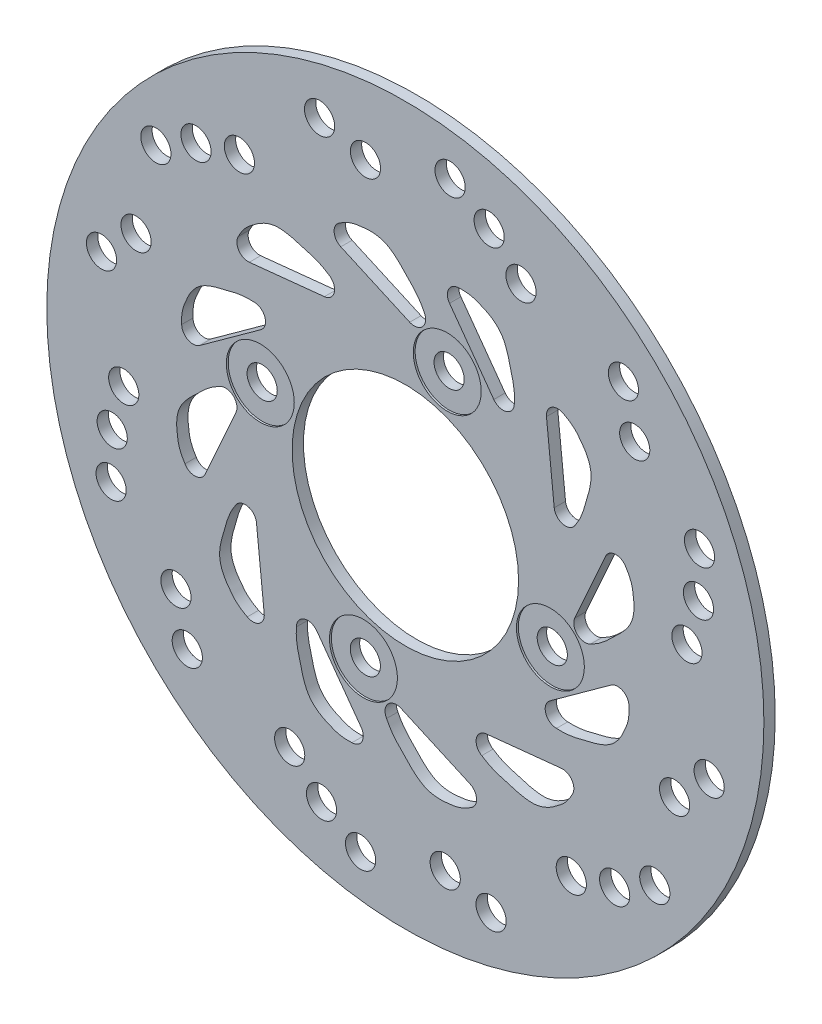
from build123d import *

# Parameters (mm, degrees)
SKETCH1_R           = 95
SKETCH1_R_2         = 30
BOSS_EXTRUDE1_DEPTH = 3
CUT_EXTRUDE1_REACH  = 136.384
SKETCH2_R           = 4
CIRPATTERN1_COUNT   = 6
SKETCH3_R           = 4
SKETCH3_R_2         = 9
CUT_EXTRUDE3_DEPTH  = 0.5
SKETCH4_R           = 4
CUT_EXTRUDE4_DEPTH  = 135.373546504
SKETCH6_R           = 4
CUT_EXTRUDE6_DEPTH  = 135.383778783


with BuildPart() as part:
    # Sketch1 → Boss-Extrude1 (new body)
    with BuildSketch(Plane.XY):
        Circle(SKETCH1_R)
        Circle(SKETCH1_R_2, mode=Mode.SUBTRACT)
    extrude(amount=BOSS_EXTRUDE1_DEPTH)

    # Sketch2 → Cut-Extrude1 (cut, up to next)
    with BuildSketch(Plane.XY.offset(3), mode=Mode.PRIVATE) as cut_extrude1_sk1:
        with Locations((-22.718806274, 79.830168743)):
            Circle(SKETCH2_R)
    cut_extrude1_tool1 = extrude(cut_extrude1_sk1.sketch, amount=-CUT_EXTRUDE1_REACH, mode=Mode.PRIVATE) & part.part
    # Sketch2 → Cut-Extrude1 (cut, up to next)
    with BuildSketch(Plane.XY.offset(3), mode=Mode.PRIVATE) as cut_extrude1_sk2:
        with Locations((-10.564303777, 76.271852513)):
            Circle(SKETCH2_R)
    cut_extrude1_tool2 = extrude(cut_extrude1_sk2.sketch, amount=-CUT_EXTRUDE1_REACH, mode=Mode.PRIVATE) & part.part
    # Sketch2 → Cut-Extrude1 (cut, up to next)
    with BuildSketch(Plane.XY.offset(3), mode=Mode.PRIVATE) as cut_extrude1_sk3:
        with Locations((11.856339474, 83.159047699)):
            Circle(SKETCH2_R)
    cut_extrude1_tool3 = extrude(cut_extrude1_sk3.sketch, amount=-CUT_EXTRUDE1_REACH, mode=Mode.PRIVATE) & part.part
    # Sketch2 → Cut-Extrude1 (cut, up to next)
    with BuildSketch(Plane.XY.offset(3), mode=Mode.PRIVATE) as cut_extrude1_sk4:
        with Locations((22.204244699, 76.856824793)):
            Circle(SKETCH2_R)
    cut_extrude1_tool4 = extrude(cut_extrude1_sk4.sketch, amount=-CUT_EXTRUDE1_REACH, mode=Mode.PRIVATE) & part.part
    # Sketch2 → Cut-Extrude1 (cut, up to next)
    with BuildSketch(Plane.XY.offset(3), mode=Mode.PRIVATE) as cut_extrude1_sk5:
        with Locations((30.641772331, 68.454961752)):
            Circle(SKETCH2_R)
    cut_extrude1_tool5 = extrude(cut_extrude1_sk5.sketch, amount=-CUT_EXTRUDE1_REACH, mode=Mode.PRIVATE) & part.part
    cut_extrude1_1 = cut_extrude1_tool1.solids().sort_by_distance((-22.718806, 79.830169, 3))[0]
    add(cut_extrude1_1, mode=Mode.SUBTRACT)
    cut_extrude1_2 = cut_extrude1_tool2.solids().sort_by_distance((-10.564304, 76.271853, 3))[0]
    add(cut_extrude1_2, mode=Mode.SUBTRACT)
    cut_extrude1_3 = cut_extrude1_tool3.solids().sort_by_distance((11.856339, 83.159048, 3))[0]
    add(cut_extrude1_3, mode=Mode.SUBTRACT)
    cut_extrude1_4 = cut_extrude1_tool4.solids().sort_by_distance((22.204245, 76.856825, 3))[0]
    add(cut_extrude1_4, mode=Mode.SUBTRACT)
    cut_extrude1_5 = cut_extrude1_tool5.solids().sort_by_distance((30.641772, 68.454962, 3))[0]
    add(cut_extrude1_5, mode=Mode.SUBTRACT)
    cut_extrude1 = cut_extrude1_1 + cut_extrude1_2 + cut_extrude1_3 + cut_extrude1_4 + cut_extrude1_5  # Cut-Extrude1 as one shape, for the pattern or mirror that repeats it

    # CirPattern1: Cut-Extrude1 ×6 about axis
    cirpattern1_axis = Axis((0, 0, 0), (0, 0, 1))
    for i in range(1, CIRPATTERN1_COUNT):
        add(cut_extrude1.rotate(cirpattern1_axis, i * 360 / CIRPATTERN1_COUNT), mode=Mode.SUBTRACT)

    # Sketch3 → Cut-Extrude3 (cut)
    with BuildSketch(Plane.XY.offset(3)):
        with Locations((22.204244699, 76.856824793)):
            Circle(SKETCH3_R)
        with Locations((11.10212235, 38.428412397)):
            Circle(SKETCH3_R_2)
        with Locations((38.428412397, -11.10212235)):
            Circle(SKETCH3_R_2)
        with Locations((-11.10212235, -38.428412397)):
            Circle(SKETCH3_R_2)
        with Locations((-38.428412397, 11.10212235)):
            Circle(SKETCH3_R_2)
    extrude(amount=-CUT_EXTRUDE3_DEPTH, mode=Mode.SUBTRACT)

    # Sketch4 → Cut-Extrude4 (cut, through all)
    with BuildSketch(Plane.XY.offset(2.5)):
        with Locations((11.10212235, 38.428412397)):
            Circle(SKETCH4_R)
        with Locations((38.428412397, -11.10212235)):
            Circle(SKETCH4_R)
        with Locations((-11.10212235, -38.428412397)):
            Circle(SKETCH4_R)
        with Locations((-38.428412397, 11.10212235)):
            Circle(SKETCH4_R)
    extrude(amount=-CUT_EXTRUDE4_DEPTH, mode=Mode.SUBTRACT)

    # Sketch6 → Cut-Extrude6 (cut, through all)
    with BuildSketch(Plane.XY.offset(3)):
        with Locations((22.204244699, 76.856824793)):
            Circle(SKETCH6_R)
        with BuildLine():
            Line((11.713067763, 54.490554937), (23.436494357, 38.286812502))
            ThreePointArc((23.436494357, 38.286812502), (26.791262383, 37.191234333), (28.867055722, 40.045326491))
            add(Edge.make_bspline(
                [(14.143629128, 59.249068926), (17.597044301, 59.429990737), (19.224423112, 58.427017972), (21.525123791, 57.578586895), (26.020798822, 55.13924055), (27.454832313, 49.544497782), (29.115166994, 42.508006827), (28.861136389, 40.957282294), (28.867055722, 40.045326491)],
                knots=[0, 0, 0, 0, 0.283284899, 0.338844181, 0.555592824, 0.777992957, 0.822433675, 1, 1, 1, 1], degree=3))
            ThreePointArc((14.143629128, 59.249068926), (11.471968412, 57.613704048), (11.713067763, 54.490554937))
        make_face()
        with BuildLine():
            Line((37.389091708, 41.33367096), (39.44000574, 21.439105078))
            ThreePointArc((39.44000574, 21.439105078), (41.79753099, 18.812922539), (45.022266833, 20.246742183))
            add(Edge.make_bspline(
                [(41.87327659, 44.239384277), (44.954482765, 42.669359575), (45.862347774, 40.987070275), (47.43059747, 39.101957069), (50.104293082, 34.741583651), (48.54883113, 29.179377541), (46.468477666, 22.255430279), (45.473118442, 21.039478742), (45.022266833, 20.246742183)],
                knots=[0, 0, 0, 0, 0.283284899, 0.338844181, 0.555592824, 0.777992957, 0.822433675, 1, 1, 1, 1], degree=3))
            ThreePointArc((41.87327659, 44.239384277), (38.7418681, 44.158947106), (37.389091708, 41.33367096))
        make_face()
        with BuildLine():
            Line((53.046738724, 17.10146323), (44.875599435, -1.153193238))
            ThreePointArc((44.875599435, -1.153193238), (45.604184922, -4.606296657), (49.113797905, -4.976940342))
            add(Edge.make_bspline(
                [(58.383013405, 17.375792336), (60.266403875, 14.475507973), (60.211493387, 12.564670198), (60.627080861, 10.147989425), (60.762382473, 5.034947468), (56.634209853, 0.995666652), (51.370597273, -3.960470839), (49.900615131, -4.515836148), (49.113797905, -4.976940342)],
                knots=[0, 0, 0, 0, 0.283284899, 0.338844181, 0.555592824, 0.777992957, 0.822433675, 1, 1, 1, 1], degree=3))
            ThreePointArc((58.383013405, 17.375792336), (55.630915518, 18.871835948), (53.046738724, 17.10146323))
        make_face()
        with BuildLine():
            Line((54.490554937, -11.713067763), (38.286812502, -23.436494357))
            ThreePointArc((38.286812502, -23.436494357), (37.191234333, -26.791262383), (40.045326491, -28.867055722))
            add(Edge.make_bspline(
                [(59.249068926, -14.143629128), (59.429990737, -17.597044301), (58.427017972, -19.224423112), (57.578586895, -21.525123791), (55.13924055, -26.020798822), (49.544497782, -27.454832313), (42.508006827, -29.115166994), (40.957282294, -28.861136389), (40.045326491, -28.867055722)],
                knots=[0, 0, 0, 0, 0.283284899, 0.338844181, 0.555592824, 0.777992957, 0.822433675, 1, 1, 1, 1], degree=3))
            ThreePointArc((59.249068926, -14.143629128), (57.613704048, -11.471968412), (54.490554937, -11.713067763))
        make_face()
        with BuildLine():
            Line((41.33367096, -37.389091708), (21.439105078, -39.44000574))
            ThreePointArc((21.439105078, -39.44000574), (18.812922539, -41.79753099), (20.246742183, -45.022266833))
            add(Edge.make_bspline(
                [(44.239384277, -41.87327659), (42.669359575, -44.954482765), (40.987070275, -45.862347774), (39.101957069, -47.43059747), (34.741583651, -50.104293082), (29.179377541, -48.54883113), (22.255430279, -46.468477666), (21.039478742, -45.473118442), (20.246742183, -45.022266833)],
                knots=[0, 0, 0, 0, 0.283284899, 0.338844181, 0.555592824, 0.777992957, 0.822433675, 1, 1, 1, 1], degree=3))
            ThreePointArc((44.239384277, -41.87327659), (44.158947106, -38.7418681), (41.33367096, -37.389091708))
        make_face()
        with BuildLine():
            Line((17.10146323, -53.046738724), (-1.153193238, -44.875599435))
            ThreePointArc((-1.153193238, -44.875599435), (-4.606296657, -45.604184922), (-4.976940342, -49.113797905))
            add(Edge.make_bspline(
                [(17.375792336, -58.383013405), (14.475507973, -60.266403875), (12.564670198, -60.211493387), (10.147989425, -60.627080861), (5.034947468, -60.762382473), (0.995666652, -56.634209853), (-3.960470839, -51.370597273), (-4.515836148, -49.900615131), (-4.976940342, -49.113797905)],
                knots=[0, 0, 0, 0, 0.283284899, 0.338844181, 0.555592824, 0.777992957, 0.822433675, 1, 1, 1, 1], degree=3))
            ThreePointArc((17.375792336, -58.383013405), (18.871835948, -55.630915518), (17.10146323, -53.046738724))
        make_face()
        with BuildLine():
            Line((-11.713067763, -54.490554937), (-23.436494357, -38.286812502))
            ThreePointArc((-23.436494357, -38.286812502), (-26.791262383, -37.191234333), (-28.867055722, -40.045326491))
            add(Edge.make_bspline(
                [(-14.143629128, -59.249068926), (-17.597044301, -59.429990737), (-19.224423112, -58.427017972), (-21.525123791, -57.578586895), (-26.020798822, -55.13924055), (-27.454832313, -49.544497782), (-29.115166994, -42.508006827), (-28.861136389, -40.957282294), (-28.867055722, -40.045326491)],
                knots=[0, 0, 0, 0, 0.283284899, 0.338844181, 0.555592824, 0.777992957, 0.822433675, 1, 1, 1, 1], degree=3))
            ThreePointArc((-14.143629128, -59.249068926), (-11.471968412, -57.613704048), (-11.713067763, -54.490554937))
        make_face()
        with BuildLine():
            Line((-37.389091708, -41.33367096), (-39.44000574, -21.439105078))
            ThreePointArc((-39.44000574, -21.439105078), (-41.79753099, -18.812922539), (-45.022266833, -20.246742183))
            add(Edge.make_bspline(
                [(-41.87327659, -44.239384277), (-44.954482765, -42.669359575), (-45.862347774, -40.987070275), (-47.43059747, -39.101957069), (-50.104293082, -34.741583651), (-48.54883113, -29.179377541), (-46.468477666, -22.255430279), (-45.473118442, -21.039478742), (-45.022266833, -20.246742183)],
                knots=[0, 0, 0, 0, 0.283284899, 0.338844181, 0.555592824, 0.777992957, 0.822433675, 1, 1, 1, 1], degree=3))
            ThreePointArc((-41.87327659, -44.239384277), (-38.7418681, -44.158947106), (-37.389091708, -41.33367096))
        make_face()
        with BuildLine():
            Line((-53.046738724, -17.10146323), (-44.875599435, 1.153193238))
            ThreePointArc((-44.875599435, 1.153193238), (-45.604184922, 4.606296657), (-49.113797905, 4.976940342))
            add(Edge.make_bspline(
                [(-58.383013405, -17.375792336), (-60.266403875, -14.475507973), (-60.211493387, -12.564670198), (-60.627080861, -10.147989425), (-60.762382473, -5.034947468), (-56.634209853, -0.995666652), (-51.370597273, 3.960470839), (-49.900615131, 4.515836148), (-49.113797905, 4.976940342)],
                knots=[0, 0, 0, 0, 0.283284899, 0.338844181, 0.555592824, 0.777992957, 0.822433675, 1, 1, 1, 1], degree=3))
            ThreePointArc((-58.383013405, -17.375792336), (-55.630915518, -18.871835948), (-53.046738724, -17.10146323))
        make_face()
        with BuildLine():
            Line((-54.490554937, 11.713067763), (-38.286812502, 23.436494357))
            ThreePointArc((-38.286812502, 23.436494357), (-37.191234333, 26.791262383), (-40.045326491, 28.867055722))
            add(Edge.make_bspline(
                [(-59.249068926, 14.143629128), (-59.429990737, 17.597044301), (-58.427017972, 19.224423112), (-57.578586895, 21.525123791), (-55.13924055, 26.020798822), (-49.544497782, 27.454832313), (-42.508006827, 29.115166994), (-40.957282294, 28.861136389), (-40.045326491, 28.867055722)],
                knots=[0, 0, 0, 0, 0.283284899, 0.338844181, 0.555592824, 0.777992957, 0.822433675, 1, 1, 1, 1], degree=3))
            ThreePointArc((-59.249068926, 14.143629128), (-57.613704048, 11.471968412), (-54.490554937, 11.713067763))
        make_face()
        with BuildLine():
            Line((-41.33367096, 37.389091708), (-21.439105078, 39.44000574))
            ThreePointArc((-21.439105078, 39.44000574), (-18.812922539, 41.79753099), (-20.246742183, 45.022266833))
            add(Edge.make_bspline(
                [(-44.239384277, 41.87327659), (-42.669359575, 44.954482765), (-40.987070275, 45.862347774), (-39.101957069, 47.43059747), (-34.741583651, 50.104293082), (-29.179377541, 48.54883113), (-22.255430279, 46.468477666), (-21.039478742, 45.473118442), (-20.246742183, 45.022266833)],
                knots=[0, 0, 0, 0, 0.283284899, 0.338844181, 0.555592824, 0.777992957, 0.822433675, 1, 1, 1, 1], degree=3))
            ThreePointArc((-44.239384277, 41.87327659), (-44.158947106, 38.7418681), (-41.33367096, 37.389091708))
        make_face()
        with BuildLine():
            Line((-17.10146323, 53.046738724), (1.153193238, 44.875599435))
            ThreePointArc((1.153193238, 44.875599435), (4.606296657, 45.604184922), (4.976940342, 49.113797905))
            add(Edge.make_bspline(
                [(-17.375792336, 58.383013405), (-14.475507973, 60.266403875), (-12.564670198, 60.211493387), (-10.147989425, 60.627080861), (-5.034947468, 60.762382473), (-0.995666652, 56.634209853), (3.960470839, 51.370597273), (4.515836148, 49.900615131), (4.976940342, 49.113797905)],
                knots=[0, 0, 0, 0, 0.283284899, 0.338844181, 0.555592824, 0.777992957, 0.822433675, 1, 1, 1, 1], degree=3))
            ThreePointArc((-17.375792336, 58.383013405), (-18.871835948, 55.630915518), (-17.10146323, 53.046738724))
        make_face()
    extrude(amount=-CUT_EXTRUDE6_DEPTH, mode=Mode.SUBTRACT)


solid = part.part
